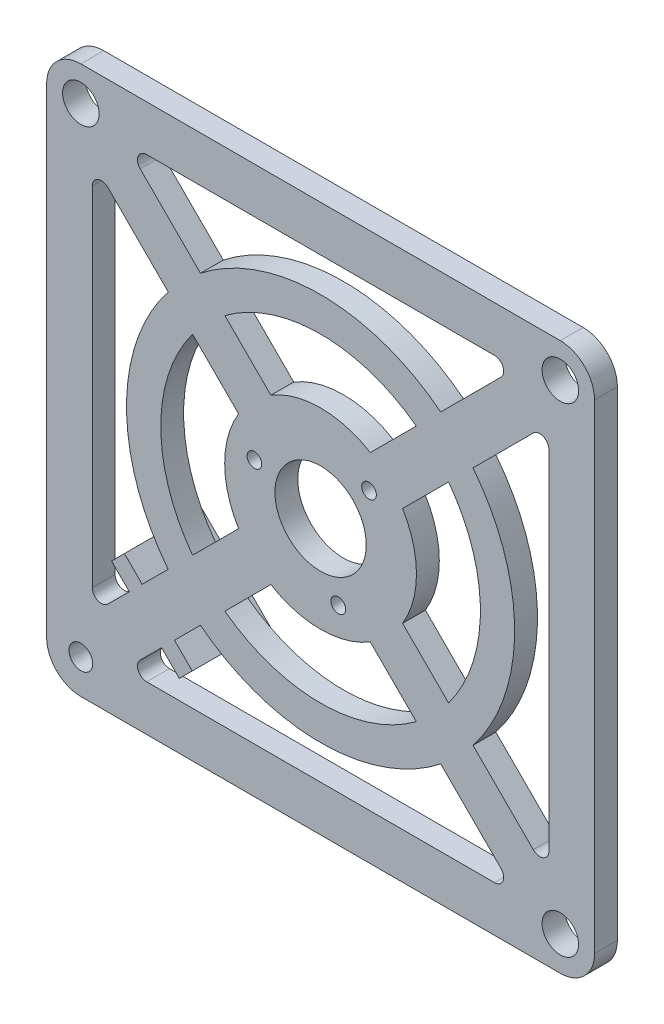
from build123d import *

# Parameters (mm, degrees)
SKETCH1_R                  = 4
SKETCH1_R_2                = 10
EXTRUDE1_DEPTH             = 2.5
FILLET1_R                  = 2
EXTRUDE5_REACH             = 87
SKETCH6_R                  = 1.6
EXTRUDE6_START             = -5
SKETCH7_R                  = 4
EXTRUDE6_DEPTH             = 5
SKETCH10_R                 = 2.6
EXTRUDE7_DEPTH             = 10
EXTRUDE8_DEPTH             = 12
EXTRUDE8_DIRECTION_2_REACH = 87
SKETCH12_R                 = 1.3
EXTRUDE9_DEPTH             = 10


with BuildPart() as part:
    # Sketch1 → Extrude1 (new, symmetric)
    with BuildSketch(Plane.XY):
        with BuildLine():
            Line((52.5, 60), (-52.5, 60))
            ThreePointArc((-52.5, 60), (-57.803300859, 57.803300859), (-60, 52.5))
            Line((-60, 52.5), (-60, -52.5))
            ThreePointArc((-60, -52.5), (-57.803300859, -57.803300859), (-52.5, -60))
            Line((-52.5, -60), (52.5, -60))
            ThreePointArc((52.5, -60), (57.803300859, -57.803300859), (60, -52.5))
            Line((60, -52.5), (60, 52.5))
            ThreePointArc((60, 52.5), (57.803300859, 57.803300859), (52.5, 60))
        make_face()
        with BuildLine():
            Line((-50, 42.928932188), (-33.378874872, 26.30780706))
            ThreePointArc((-33.378874872, 26.30780706), (-42.5, 0), (-33.378874872, -26.30780706))
            Line((-33.378874872, -26.30780706), (-50, -42.928932188))
            Line((-50, -42.928932188), (-50, 42.928932188))
        make_face(mode=Mode.SUBTRACT)
        with Locations((-52.5, -52.5)):
            Circle(SKETCH1_R, mode=Mode.SUBTRACT)
        with BuildLine():
            Line((-42.928932188, -50), (-26.30780706, -33.378874872))
            ThreePointArc((-26.30780706, -33.378874872), (0, -42.5), (26.30780706, -33.378874872))
            Line((26.30780706, -33.378874872), (42.928932188, -50))
            Line((42.928932188, -50), (-42.928932188, -50))
        make_face(mode=Mode.SUBTRACT)
        with Locations((52.5, -52.5)):
            Circle(SKETCH1_R, mode=Mode.SUBTRACT)
        with BuildLine():
            Line((50, -42.928932188), (33.378874872, -26.30780706))
            ThreePointArc((33.378874872, -26.30780706), (42.5, 0), (33.378874872, 26.30780706))
            Line((33.378874872, 26.30780706), (50, 42.928932188))
            Line((50, 42.928932188), (50, -42.928932188))
        make_face(mode=Mode.SUBTRACT)
        with Locations((52.5, 52.5)):
            Circle(SKETCH1_R, mode=Mode.SUBTRACT)
        with BuildLine():
            Line((42.928932188, 50), (26.30780706, 33.378874872))
            ThreePointArc((26.30780706, 33.378874872), (0, 42.5), (-26.30780706, 33.378874872))
            Line((-26.30780706, 33.378874872), (-42.928932188, 50))
            Line((-42.928932188, 50), (42.928932188, 50))
        make_face(mode=Mode.SUBTRACT)
        with Locations((-52.5, 52.5)):
            Circle(SKETCH1_R, mode=Mode.SUBTRACT)
        with BuildLine():
            Line((-20.959363522, -28.030431334), (-10.886671196, -17.957739008))
            ThreePointArc((-10.886671196, -17.957739008), (0, -21), (10.886671196, -17.957739008))
            Line((10.886671196, -17.957739008), (20.959363522, -28.030431334))
            ThreePointArc((20.959363522, -28.030431334), (0, -35), (-20.959363522, -28.030431334))
        make_face(mode=Mode.SUBTRACT)
        with BuildLine():
            ThreePointArc((17.957739008, -10.886671196), (21, 0), (17.957739008, 10.886671196))
            Line((17.957739008, 10.886671196), (28.030431334, 20.959363522))
            ThreePointArc((28.030431334, 20.959363522), (35, 0), (28.030431334, -20.959363522))
            Line((28.030431334, -20.959363522), (17.957739008, -10.886671196))
        make_face(mode=Mode.SUBTRACT)
        with BuildLine():
            ThreePointArc((10.886671196, 17.957739008), (0, 21), (-10.886671196, 17.957739008))
            Line((-10.886671196, 17.957739008), (-20.959363522, 28.030431334))
            ThreePointArc((-20.959363522, 28.030431334), (0, 35), (20.959363522, 28.030431334))
            Line((20.959363522, 28.030431334), (10.886671196, 17.957739008))
        make_face(mode=Mode.SUBTRACT)
        with BuildLine():
            Line((-17.957739008, -10.886671196), (-28.030431334, -20.959363522))
            ThreePointArc((-28.030431334, -20.959363522), (-35, 0), (-28.030431334, 20.959363522))
            Line((-28.030431334, 20.959363522), (-17.957739008, 10.886671196))
            ThreePointArc((-17.957739008, 10.886671196), (-21, 0), (-17.957739008, -10.886671196))
        make_face(mode=Mode.SUBTRACT)
        Circle(SKETCH1_R_2, mode=Mode.SUBTRACT)
    extrude(amount=EXTRUDE1_DEPTH, both=True)

    # Fillet1
    fillet1_edges = [part.edges().sort_by_distance(p)[0] for p in [
        (50, 42.928932188, 0),
        (50, -42.928932188, 0),
        (42.928932188, 50, 0),
        (-42.928932188, 50, 0),
        (-50, 42.928932188, 0),
        (-50, -42.928932188, 0),
        (-42.928932188, -50, 0),
        (42.928932188, -50, 0),
    ]]
    fillet(fillet1_edges, radius=FILLET1_R)

    # Sketch6 → Extrude5 (cut, up to next)
    with BuildSketch(Plane(origin=(0, 0, -2.5), x_dir=(-1, 0, 0), z_dir=(0, 0, -1)), mode=Mode.PRIVATE) as extrude5_sk1:
        with Locations((-10.606601718, 10.606601718)):
            Circle(SKETCH6_R)
    extrude5_tool1 = extrude(extrude5_sk1.sketch, amount=-EXTRUDE5_REACH, mode=Mode.PRIVATE) & part.part
    # Sketch6 → Extrude5 (cut, up to next)
    with BuildSketch(Plane(origin=(0, 0, -2.5), x_dir=(-1, 0, 0), z_dir=(0, 0, -1)), mode=Mode.PRIVATE) as extrude5_sk2:
        with Locations((14.488887394, 3.882285677)):
            Circle(SKETCH6_R)
    extrude5_tool2 = extrude(extrude5_sk2.sketch, amount=-EXTRUDE5_REACH, mode=Mode.PRIVATE) & part.part
    # Sketch6 → Extrude5 (cut, up to next)
    with BuildSketch(Plane(origin=(0, 0, -2.5), x_dir=(-1, 0, 0), z_dir=(0, 0, -1)), mode=Mode.PRIVATE) as extrude5_sk3:
        with Locations((-3.882285677, -14.488887394)):
            Circle(SKETCH6_R)
    extrude5_tool3 = extrude(extrude5_sk3.sketch, amount=-EXTRUDE5_REACH, mode=Mode.PRIVATE) & part.part
    add(extrude5_tool1.solids().sort_by_distance((10.606602, 10.606602, -2.5))[0], mode=Mode.SUBTRACT)
    add(extrude5_tool2.solids().sort_by_distance((-14.488887, 3.882286, -2.5))[0], mode=Mode.SUBTRACT)
    add(extrude5_tool3.solids().sort_by_distance((3.882286, -14.488887, -2.5))[0], mode=Mode.SUBTRACT)

    # Sketch7 → Extrude6 (add)
    with BuildSketch(Plane.XY.offset(2.5).offset(EXTRUDE6_START)):
        with Locations((-52.5, -52.5)):
            Circle(SKETCH7_R)
    extrude(amount=EXTRUDE6_DEPTH)

    # Sketch10 → Extrude7 (cut)
    with BuildSketch(Plane(origin=(0, 0, -2.5), x_dir=(-1, 0, 0), z_dir=(0, 0, -1))):
        with Locations((52.5, -52.5)):
            Circle(SKETCH10_R)
    extrude(amount=-EXTRUDE7_DEPTH, mode=Mode.SUBTRACT)

    # Sketch11 → Extrude8 (add)
    with BuildSketch(Plane(origin=(0, 0, -2.5), x_dir=(-1, 0, 0), z_dir=(0, 0, -1))):
        Polygon((28.104816049, -42.954058454), (42.954058454, -28.104816049), (45.782485579, -30.933243174), (30.933243174, -45.782485579), align=None)
    extrude(amount=EXTRUDE8_DEPTH)

    # Extrude8 direction 2: up to this face of the body (flat: up to its plane)
    extrude8_direction_2_end = Plane(part.part.faces().sort_by_distance((0, 58.302943725, 2.5))[0])
    # Sketch11 → Extrude8 direction 2 (add, up to the picked face)
    with BuildSketch(Plane(origin=(0, 0, -2.5), x_dir=(-1, 0, 0), z_dir=(0, 0, -1)), mode=Mode.PRIVATE) as extrude8_direction_2_sk1:
        Polygon((28.104816049, -42.954058454), (42.954058454, -28.104816049), (45.782485579, -30.933243174), (30.933243174, -45.782485579), align=None)
    extrude8_direction_2_tool1 = split(extrude(extrude8_direction_2_sk1.sketch, amount=-EXTRUDE8_DIRECTION_2_REACH, mode=Mode.PRIVATE), bisect_by=extrude8_direction_2_end, keep=Keep.BOTH, mode=Mode.PRIVATE)
    add(extrude8_direction_2_tool1.solids().sort_by(Axis((-36.943651, -36.943651, -2.5), (0, 0, 1)))[0])

    # Sketch12 → Extrude9 (cut)
    with BuildSketch(Plane(origin=(-35.529437252, -35.529437252, 0), x_dir=(0, 0, -1), z_dir=(0.7071067811865501, 0.7071067811865449, 0))):
        with Locations(Location((5, -8.25, 0), (0, 0, 90))):
            Circle(SKETCH12_R)
        with Locations(Location((5, 8.25, 0), (0, 0, 90))):
            Circle(SKETCH12_R)
    extrude(amount=-EXTRUDE9_DEPTH, mode=Mode.SUBTRACT)


solid = part.part
